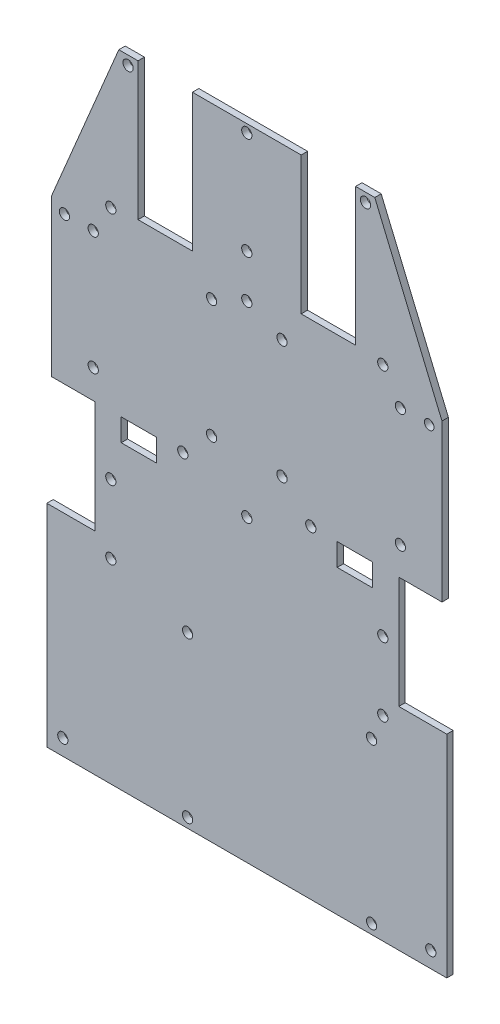
from build123d import *

# Parameters (mm, degrees)
SKETCH_1_R      = 1.6
SKETCH_1_W      = 11
SKETCH_1_H      = 7
SKETCH_1_R_2    = 1.5
EXTRUDE_1_DEPTH = 2


with BuildPart() as part:
    # 草圖1 → 填料-伸長1 (new body)
    with BuildSketch(Plane.XY):
        Polygon((62.5, 0), (62.5, 66), (47.5, 66), (47.5, 101), (61, 101), (61, 150), (40, 200), (34, 200), (34, 157), (17, 157), (17, 200), (-17, 200), (-17, 157), (-34, 157), (-34, 200), (-40, 200), (-61, 150), (-61, 101), (-47.5, 101), (-47.5, 66), (-62.5, 66), (-62.5, 0), align=None)
        with Locations((-18.5, 3)):
            Circle(SKETCH_1_R, mode=Mode.SUBTRACT)
        with Locations((-18.5, 53)):
            Circle(SKETCH_1_R, mode=Mode.SUBTRACT)
        with Locations((39, 3)):
            Circle(SKETCH_1_R, mode=Mode.SUBTRACT)
        with Locations((39, 53)):
            Circle(SKETCH_1_R, mode=Mode.SUBTRACT)
        with Locations((42.5, 156)):
            Circle(SKETCH_1_R, mode=Mode.SUBTRACT)
        with Locations((0, 197.5)):
            Circle(SKETCH_1_R, mode=Mode.SUBTRACT)
        with Locations((37.09943713, 197.209058014)):
            Circle(SKETCH_1_R, mode=Mode.SUBTRACT)
        with Locations((-57.5, 5)):
            Circle(SKETCH_1_R, mode=Mode.SUBTRACT)
        with Locations((-42.5, 61)):
            Circle(SKETCH_1_R, mode=Mode.SUBTRACT)
        with Locations((-42.5, 82.5)):
            Circle(SKETCH_1_R, mode=Mode.SUBTRACT)
        with Locations((-33.75, 97.5)):
            Rectangle(SKETCH_1_W, SKETCH_1_H, mode=Mode.SUBTRACT)
        with Locations((57.5, 5)):
            Circle(SKETCH_1_R, mode=Mode.SUBTRACT)
        with Locations((42.5, 61)):
            Circle(SKETCH_1_R, mode=Mode.SUBTRACT)
        with Locations((0, 93.5)):
            Circle(SKETCH_1_R, mode=Mode.SUBTRACT)
        with Locations((42.5, 82.5)):
            Circle(SKETCH_1_R, mode=Mode.SUBTRACT)
        with Locations((33.75, 97.5)):
            Rectangle(SKETCH_1_W, SKETCH_1_H, mode=Mode.SUBTRACT)
        with Locations((-56.996650272, 147.008451352)):
            Circle(SKETCH_1_R, mode=Mode.SUBTRACT)
        with Locations((-20, 101)):
            Circle(SKETCH_1_R, mode=Mode.SUBTRACT)
        with Locations((-42.5, 156)):
            Circle(SKETCH_1_R, mode=Mode.SUBTRACT)
        with Locations((-37.09943713, 197.209058014)):
            Circle(SKETCH_1_R, mode=Mode.SUBTRACT)
        with Locations((20, 101)):
            Circle(SKETCH_1_R, mode=Mode.SUBTRACT)
        with Locations((56.996650272, 147.008451352)):
            Circle(SKETCH_1_R_2, mode=Mode.SUBTRACT)
        with Locations((0, 152)):
            Circle(SKETCH_1_R, mode=Mode.SUBTRACT)
        with Locations((0, 165.5)):
            Circle(SKETCH_1_R, mode=Mode.SUBTRACT)
        with Locations((47.996650272, 110)):
            Circle(SKETCH_1_R, mode=Mode.SUBTRACT)
        with Locations((11, 147)):
            Circle(SKETCH_1_R, mode=Mode.SUBTRACT)
        with Locations((11, 110)):
            Circle(SKETCH_1_R, mode=Mode.SUBTRACT)
        with Locations((47.996650272, 147)):
            Circle(SKETCH_1_R, mode=Mode.SUBTRACT)
        with Locations((-11, 110)):
            Circle(SKETCH_1_R, mode=Mode.SUBTRACT)
        with Locations((-48, 147)):
            Circle(SKETCH_1_R, mode=Mode.SUBTRACT)
        with Locations((-48, 110)):
            Circle(SKETCH_1_R, mode=Mode.SUBTRACT)
        with Locations((-11, 147)):
            Circle(SKETCH_1_R, mode=Mode.SUBTRACT)
    extrude(amount=EXTRUDE_1_DEPTH)


solid = part.part
